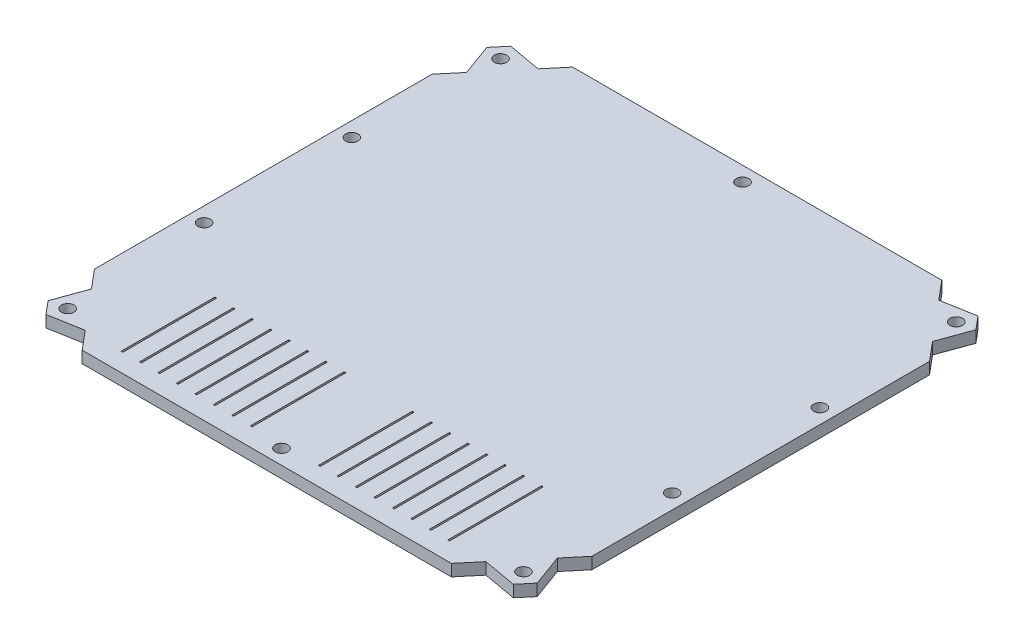
from build123d import *

# Parameters (mm, degrees)
SKETCH1_W               = 269.4
SKETCH1_H               = 265.6
BOSS_EXTRUDE1_DEPTH     = 3.175
CUT_EXTRUDE3_DEPTH      = 190.262390612
BOSS_EXTRUDE3_DEPTH     = 6.35
F_1_4_CLEARANCE_HOLE1_D = 6.7564
MIRROR2_COPY_1_DEPTH    = 6.35
MIRROR2_COPY_2_D        = 6.7564
CUT_EXTRUDE2_REACH      = 191.262
SKETCH15_W              = 0.944
SKETCH15_H              = 50.8
LPATTERN1_COUNT         = 8
LPATTERN1_PITCH         = 10
MIRROR3_COPY_1_REACH    = 191.262
MIRROR3_COPY_1_SKETCH_W = 0.944
MIRROR3_COPY_1_SKETCH_H = 50.8
MIRROR3_COPY_2_REACH    = 191.262
MIRROR3_COPY_2_SKETCH_W = 0.944
MIRROR3_COPY_2_SKETCH_H = 50.8
MIRROR3_COPY_3_REACH    = 191.262
MIRROR3_COPY_3_SKETCH_W = 0.944
MIRROR3_COPY_3_SKETCH_H = 50.8
MIRROR3_COPY_4_REACH    = 191.262
MIRROR3_COPY_4_SKETCH_W = 0.944
MIRROR3_COPY_4_SKETCH_H = 50.8
MIRROR3_COPY_5_REACH    = 191.262
MIRROR3_COPY_5_SKETCH_W = 0.944
MIRROR3_COPY_5_SKETCH_H = 50.8
MIRROR3_COPY_6_REACH    = 191.262
MIRROR3_COPY_6_SKETCH_W = 0.944
MIRROR3_COPY_6_SKETCH_H = 50.8
MIRROR3_COPY_7_REACH    = 191.262
MIRROR3_COPY_7_SKETCH_W = 0.944
MIRROR3_COPY_7_SKETCH_H = 50.8


with BuildPart() as part:
    # Sketch1 → Boss-Extrude1 (new, symmetric)
    with BuildSketch(Plane(origin=(0, 0, 0), x_dir=(1, 0, 0), z_dir=(0, 1, 0))):
        Rectangle(SKETCH1_W, SKETCH1_H)
    extrude(amount=BOSS_EXTRUDE1_DEPTH, both=True)

    # Sketch16 → Cut-Extrude3 (cut, through all)
    with BuildSketch(Plane(origin=(0, 3.175, 0), x_dir=(1, 0, 0), z_dir=(0, 1, 0))):
        Polygon((-134.7, 132.8), (-134.7, 91.434816919), (-99.990490133, 132.8), align=None)
        Polygon((99.990490133, 132.8), (134.7, 132.8), (134.7, 91.434816919), align=None)
        Polygon((134.7, -132.8), (134.7, -91.434816919), (99.990490133, -132.8), align=None)
        Polygon((-99.990490133, -132.8), (-134.7, -132.8), (-134.7, -91.434816919), align=None)
    extrude(amount=-CUT_EXTRUDE3_DEPTH, mode=Mode.SUBTRACT)

    # Sketch7 → Boss-Extrude3 (add)
    with BuildSketch(Plane(origin=(0, -3.175, 0), x_dir=(1, 0, 0), z_dir=(0, 1, 0))):
        Polygon((126.560486405, 125.832227239), (132.451914797, 118.811096288), (126.182387654, 101.585712032), (108.508102479, 122.649104887), align=None)
    boss_extrude3 = extrude(amount=BOSS_EXTRUDE3_DEPTH)

    # 1/4 Clearance Hole1 (through all)
    with Locations(Plane.XZ.offset(3.175)):
        with Locations((123.415994069, -117.211371709), (126.7498, -40), (0, -124.8498)):
            f_1_4_clearance_hole1 = Hole(F_1_4_CLEARANCE_HOLE1_D / 2)

    # Mirror1: Boss-Extrude3, 1/4 Clearance Hole1 across plane
    add(boss_extrude3.mirror(Plane.XY))
    add(f_1_4_clearance_hole1.mirror(Plane.XY), mode=Mode.SUBTRACT)

    # Mirror2: Boss-Extrude3, 1/4 Clearance Hole1 across plane
    add(boss_extrude3.mirror(Plane(origin=(0, 0, 0), x_dir=(0, 0, 1), z_dir=(1, 0, 0))))
    add(f_1_4_clearance_hole1.mirror(Plane(origin=(0, 0, 0), x_dir=(0, 0, 1), z_dir=(1, 0, 0))), mode=Mode.SUBTRACT)

    # Mirror2 copy 1 sketch → Mirror2 copy 1 (add)
    with BuildSketch(Plane(origin=(0, -3.175, 0), x_dir=(-1, 0, 0), z_dir=(0, 1, 0))):
        Polygon((126.560486405, 125.832227239), (132.451914797, 118.811096288), (126.182387654, 101.585712032), (108.508102479, 122.649104887), align=None)
    extrude(amount=MIRROR2_COPY_1_DEPTH)

    # Mirror2 copy 2 (through all)
    with Locations(Plane(origin=(0, -3.175, 0), x_dir=(-1, 0, 0), z_dir=(0, -1, 0))):
        with Locations((123.415994069, -117.211371709), (126.7498, -40), (0, -124.8498)):
            Hole(MIRROR2_COPY_2_D / 2)

    # Sketch15 → Cut-Extrude2 (cut, up to next)
    with BuildSketch(Plane(origin=(0, 3.175, 0), x_dir=(1, 0, 0), z_dir=(0, 1, 0)), mode=Mode.PRIVATE) as cut_extrude2_sk1:
        with Locations((-88.499, -97.4)):
            Rectangle(SKETCH15_W, SKETCH15_H)
    cut_extrude2_tool1 = extrude(cut_extrude2_sk1.sketch, amount=-CUT_EXTRUDE2_REACH, mode=Mode.PRIVATE) & part.part
    cut_extrude2 = cut_extrude2_tool1.solids().sort_by_distance((-88.499, 3.175, 97.4))[0]
    add(cut_extrude2, mode=Mode.SUBTRACT)

    # LPattern1: Cut-Extrude2 ×8
    with Locations(*[(i * LPATTERN1_PITCH, 0, 0) for i in range(1, LPATTERN1_COUNT)]):
        add(cut_extrude2, mode=Mode.SUBTRACT)

    # Mirror3: Cut-Extrude2 across plane
    add(cut_extrude2.mirror(Plane(origin=(0, 0, 0), x_dir=(0, 0, 1), z_dir=(1, 0, 0))), mode=Mode.SUBTRACT)

    # Mirror3 copy 1 sketch → Mirror3 copy 1 (cut, up to next)
    with BuildSketch(Plane(origin=(-10, 3.175, 0), x_dir=(-1, 0, 0), z_dir=(0, 1, 0)), mode=Mode.PRIVATE) as mirror3_copy_1_sk1:
        with Locations((-88.499, 97.4)):
            Rectangle(MIRROR3_COPY_1_SKETCH_W, MIRROR3_COPY_1_SKETCH_H)
    mirror3_copy_1_tool1 = extrude(mirror3_copy_1_sk1.sketch, amount=-MIRROR3_COPY_1_REACH, mode=Mode.PRIVATE) & part.part
    add(mirror3_copy_1_tool1.solids().sort_by_distance((78.499, 3.175, 97.4))[0], mode=Mode.SUBTRACT)

    # Mirror3 copy 2 sketch → Mirror3 copy 2 (cut, up to next)
    with BuildSketch(Plane(origin=(-20, 3.175, 0), x_dir=(-1, 0, 0), z_dir=(0, 1, 0)), mode=Mode.PRIVATE) as mirror3_copy_2_sk1:
        with Locations((-88.499, 97.4)):
            Rectangle(MIRROR3_COPY_2_SKETCH_W, MIRROR3_COPY_2_SKETCH_H)
    mirror3_copy_2_tool1 = extrude(mirror3_copy_2_sk1.sketch, amount=-MIRROR3_COPY_2_REACH, mode=Mode.PRIVATE) & part.part
    add(mirror3_copy_2_tool1.solids().sort_by_distance((68.499, 3.175, 97.4))[0], mode=Mode.SUBTRACT)

    # Mirror3 copy 3 sketch → Mirror3 copy 3 (cut, up to next)
    with BuildSketch(Plane(origin=(-30, 3.175, 0), x_dir=(-1, 0, 0), z_dir=(0, 1, 0)), mode=Mode.PRIVATE) as mirror3_copy_3_sk1:
        with Locations((-88.499, 97.4)):
            Rectangle(MIRROR3_COPY_3_SKETCH_W, MIRROR3_COPY_3_SKETCH_H)
    mirror3_copy_3_tool1 = extrude(mirror3_copy_3_sk1.sketch, amount=-MIRROR3_COPY_3_REACH, mode=Mode.PRIVATE) & part.part
    add(mirror3_copy_3_tool1.solids().sort_by_distance((58.499, 3.175, 97.4))[0], mode=Mode.SUBTRACT)

    # Mirror3 copy 4 sketch → Mirror3 copy 4 (cut, up to next)
    with BuildSketch(Plane(origin=(-40, 3.175, 0), x_dir=(-1, 0, 0), z_dir=(0, 1, 0)), mode=Mode.PRIVATE) as mirror3_copy_4_sk1:
        with Locations((-88.499, 97.4)):
            Rectangle(MIRROR3_COPY_4_SKETCH_W, MIRROR3_COPY_4_SKETCH_H)
    mirror3_copy_4_tool1 = extrude(mirror3_copy_4_sk1.sketch, amount=-MIRROR3_COPY_4_REACH, mode=Mode.PRIVATE) & part.part
    add(mirror3_copy_4_tool1.solids().sort_by_distance((48.499, 3.175, 97.4))[0], mode=Mode.SUBTRACT)

    # Mirror3 copy 5 sketch → Mirror3 copy 5 (cut, up to next)
    with BuildSketch(Plane(origin=(-50, 3.175, 0), x_dir=(-1, 0, 0), z_dir=(0, 1, 0)), mode=Mode.PRIVATE) as mirror3_copy_5_sk1:
        with Locations((-88.499, 97.4)):
            Rectangle(MIRROR3_COPY_5_SKETCH_W, MIRROR3_COPY_5_SKETCH_H)
    mirror3_copy_5_tool1 = extrude(mirror3_copy_5_sk1.sketch, amount=-MIRROR3_COPY_5_REACH, mode=Mode.PRIVATE) & part.part
    add(mirror3_copy_5_tool1.solids().sort_by_distance((38.499, 3.175, 97.4))[0], mode=Mode.SUBTRACT)

    # Mirror3 copy 6 sketch → Mirror3 copy 6 (cut, up to next)
    with BuildSketch(Plane(origin=(-60, 3.175, 0), x_dir=(-1, 0, 0), z_dir=(0, 1, 0)), mode=Mode.PRIVATE) as mirror3_copy_6_sk1:
        with Locations((-88.499, 97.4)):
            Rectangle(MIRROR3_COPY_6_SKETCH_W, MIRROR3_COPY_6_SKETCH_H)
    mirror3_copy_6_tool1 = extrude(mirror3_copy_6_sk1.sketch, amount=-MIRROR3_COPY_6_REACH, mode=Mode.PRIVATE) & part.part
    add(mirror3_copy_6_tool1.solids().sort_by_distance((28.499, 3.175, 97.4))[0], mode=Mode.SUBTRACT)

    # Mirror3 copy 7 sketch → Mirror3 copy 7 (cut, up to next)
    with BuildSketch(Plane(origin=(-70, 3.175, 0), x_dir=(-1, 0, 0), z_dir=(0, 1, 0)), mode=Mode.PRIVATE) as mirror3_copy_7_sk1:
        with Locations((-88.499, 97.4)):
            Rectangle(MIRROR3_COPY_7_SKETCH_W, MIRROR3_COPY_7_SKETCH_H)
    mirror3_copy_7_tool1 = extrude(mirror3_copy_7_sk1.sketch, amount=-MIRROR3_COPY_7_REACH, mode=Mode.PRIVATE) & part.part
    add(mirror3_copy_7_tool1.solids().sort_by_distance((18.499, 3.175, 97.4))[0], mode=Mode.SUBTRACT)


solid = part.part
